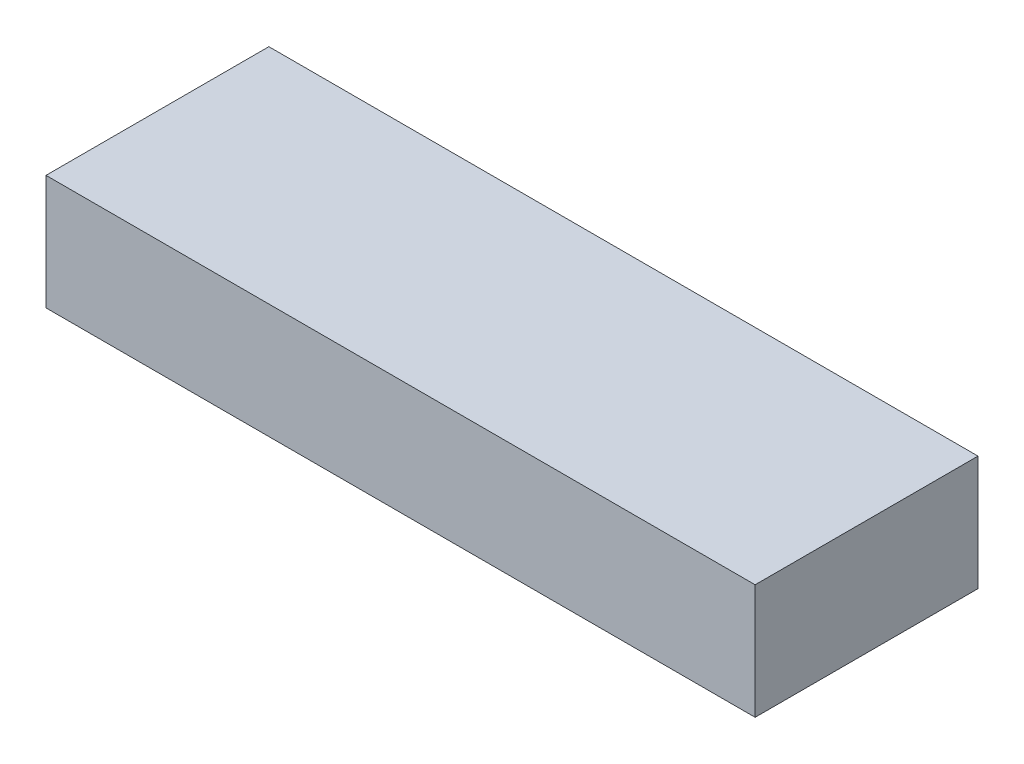
from build123d import *

# Parameters (mm, degrees)
SKETCH1_W           = 105
SKETCH1_H           = 33
BOSS_EXTRUDE1_DEPTH = 17


with BuildPart() as part:
    # Sketch1 → Boss-Extrude1 (new body)
    with BuildSketch(Plane(origin=(0, 0, 0), x_dir=(1, 0, 0), z_dir=(0, 1, 0))):
        Rectangle(SKETCH1_W, SKETCH1_H)
    extrude(amount=BOSS_EXTRUDE1_DEPTH)


solid = part.part
